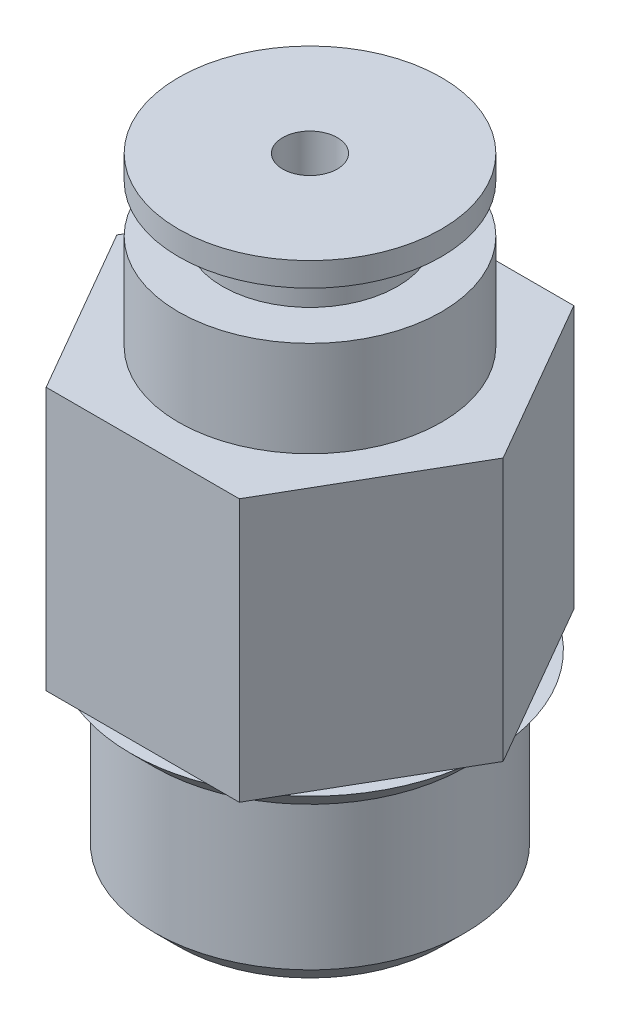
from build123d import *

# Parameters (mm, degrees)
BOSS_EXTRUDE1_DEPTH = 11
CHAMFER1_SIZE       = 1


with BuildPart() as part:
    # Sketch1 → Revolve1 (revolve)
    with BuildSketch(Plane.XY, mode=Mode.PRIVATE) as revolve1_sk:
        Polygon((3.276548208, 0), (6.5, 0), (6.5, 7), (7.5, 8), (3.276548208, 8), align=None)
    revolve(revolve1_sk.sketch.rotate(Axis((0, 18.90634256, 0), (0, -1, 0)), 90), axis=Axis((0, 18.90634256, 0), (0, -1, 0)))

    # Sketch2 → Boss-Extrude1 (add)
    with BuildSketch(Plane(origin=(0, 8, 0), x_dir=(1, 0, 0), z_dir=(0, 1, 0))):
        Polygon((8.082903769, 0), (4.041451884, 7), (-4.041451884, 7), (-8.082903769, 0), (-4.041451884, -7), (4.041451884, -7), align=None)
    extrude(amount=BOSS_EXTRUDE1_DEPTH)

    # Sketch3 → Revolve3 (revolve)
    with BuildSketch(Plane.XY, mode=Mode.PRIVATE) as revolve3_sk:
        Polygon((5.5, 19), (5.5, 23), (3.657937283, 23), (3.657937283, 25), (5.5, 25), (5.5, 26), (1.142283078, 26), (1.142283078, 19), align=None)
    revolve(revolve3_sk.sketch.rotate(Axis((0, 22.925153464, 0), (0, -1, 0)), 90), axis=Axis((0, 22.925153464, 0), (0, -1, 0)))

    # Chamfer1
    chamfer1_edges = [part.edges().sort_by_distance(p)[0] for p in [
        (0, 0, -6.5),
    ]]
    chamfer(chamfer1_edges, length=CHAMFER1_SIZE)


solid = part.part
